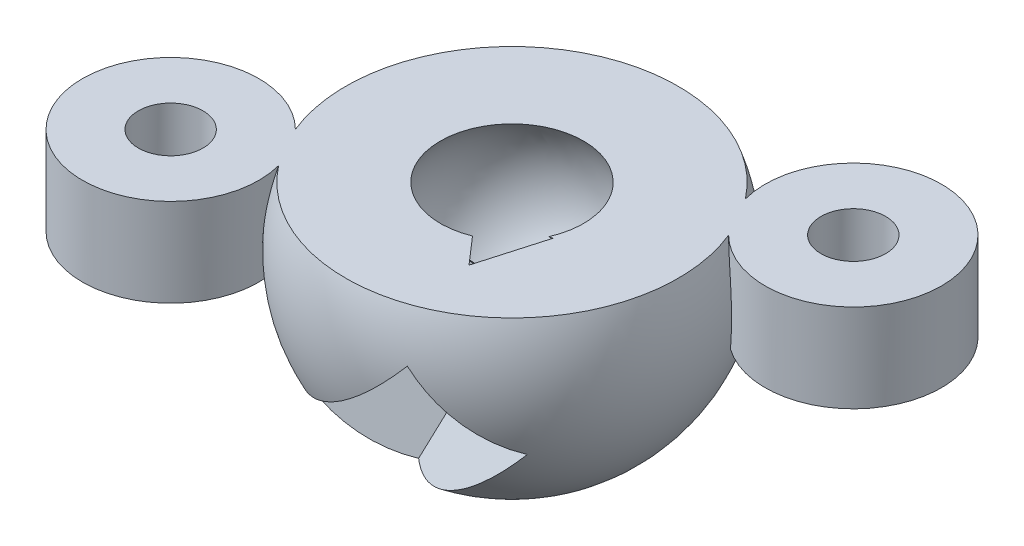
from build123d import *

# Parameters (mm, degrees)
RETAINER_FEATURE_3_PROFILE_R = 3
RETAINER_FEATURE_3_DEPTH     = 3
RETAINER_FEATURE_4_PROFILE_R = 3
RETAINER_FEATURE_4_DEPTH     = 3
RETAINER_FEATURE_6_PROFILE_R = 1.1
RETAINER_FEATURE_6_DEPTH     = 4.25
RETAINER_FEATURE_7_PROFILE_R = 2.1
RETAINER_FEATURE_7_DEPTH     = 1.45
RETAINER_FEATURE_8_PROFILE_R = 1.1
RETAINER_FEATURE_8_DEPTH     = 4.25
RETAINER_FEATURE_9_PROFILE_R = 2.1
RETAINER_FEATURE_9_DEPTH     = 1.45
RETAINER_FEATURE_12_DEPTH    = 10


with BuildPart() as part:
    # Retainer Dome Section Sketch → Retainer Dome (revolve)
    with BuildSketch(Plane(origin=(-42.218738434, 0, 24.375), x_dir=(-0.5000000000000002, 0, -0.8660254037844386), z_dir=(0.8660254037844386, 0, -0.5000000000000002)), mode=Mode.PRIVATE) as retainer_dome_sk:
        with BuildLine():
            Line((63.802679872, -71), (58.145825623, -71))
            Line((58.145825623, -71), (58.145825623, -79))
            ThreePointArc((58.145825623, -79), (63.044805109, -76.464101615), (63.802679872, -71))
        make_face()
    revolve(retainer_dome_sk.sketch.rotate(Axis((-71.291651246, -83, -25.980762114), (0, 1, 0)), 180), axis=Axis((-71.291651246, -83, -25.980762114), (0, 1, 0)))

    # Retainer Feature 3 profile → Retainer Feature 3 (add)
    with BuildSketch(Plane(origin=(0, -71, 0), x_dir=(-1, 0, 0), z_dir=(0, -1, 0))):
        with Locations((78.652867178, 21.730762114)):
            Circle(RETAINER_FEATURE_3_PROFILE_R)
    extrude(amount=RETAINER_FEATURE_3_DEPTH)

    # Retainer Feature 4 profile → Retainer Feature 4 (add)
    with BuildSketch(Plane(origin=(0, -71, 0), x_dir=(-1, 0, 0), z_dir=(0, -1, 0))):
        with Locations((63.930435314, 30.230762114)):
            Circle(RETAINER_FEATURE_4_PROFILE_R)
    extrude(amount=RETAINER_FEATURE_4_DEPTH)

    # Spherical Seat Sketch → Spherical Seat (revolve, cut)
    with BuildSketch(Plane(origin=(0, -73, 0), x_dir=(-1, 0, 0), z_dir=(0, -1, 0))):
        with BuildLine():
            Line((68.563671224, 27.555762114), (74.019631268, 24.405762114))
            ThreePointArc((74.019631268, 24.405762114), (72.866651246, 28.708742135), (68.563671224, 27.555762114))
        make_face()
    revolve(axis=Axis((-79.951905284, -73, -20.980762114), (0.8660254037844387, 0, -0.49999999999999994)), mode=Mode.SUBTRACT)

    # Retainer Feature 6 profile → Retainer Feature 6 (cut)
    with BuildSketch(Plane(origin=(0, -70, 0), x_dir=(-1, 0, 0), z_dir=(0, -1, 0))):
        with Locations(Location((78.652867178, 21.730762114, 0), (0, 0, 270))):
            Circle(RETAINER_FEATURE_6_PROFILE_R)
    extrude(amount=RETAINER_FEATURE_6_DEPTH, mode=Mode.SUBTRACT)

    # Retainer Feature 7 profile → Retainer Feature 7 (cut)
    with BuildSketch(Plane(origin=(0, -72.8, 0), x_dir=(-1, 0, 0), z_dir=(0, -1, 0))):
        with Locations(Location((78.652867178, 21.730762114, 0), (0, 0, 90))):
            Circle(RETAINER_FEATURE_7_PROFILE_R)
    extrude(amount=RETAINER_FEATURE_7_DEPTH, mode=Mode.SUBTRACT)

    # Retainer Feature 8 profile → Retainer Feature 8 (cut)
    with BuildSketch(Plane(origin=(0, -70, 0), x_dir=(-1, 0, 0), z_dir=(0, -1, 0))):
        with Locations(Location((63.930435314, 30.230762114, 0), (0, 0, 270))):
            Circle(RETAINER_FEATURE_8_PROFILE_R)
    extrude(amount=RETAINER_FEATURE_8_DEPTH, mode=Mode.SUBTRACT)

    # Retainer Feature 9 profile → Retainer Feature 9 (cut)
    with BuildSketch(Plane(origin=(0, -72.8, 0), x_dir=(-1, 0, 0), z_dir=(0, -1, 0))):
        with Locations(Location((63.930435314, 30.230762114, 0), (0, 0, 90))):
            Circle(RETAINER_FEATURE_9_PROFILE_R)
    extrude(amount=RETAINER_FEATURE_9_DEPTH, mode=Mode.SUBTRACT)

    # Middle Right Fixed Compression Ball Reta → Retainer Feature 12 (cut)
    with BuildSketch(Plane(origin=(1.086994367, -4.928521801, 7.638884182), x_dir=(0.9929271814083492, 0.06436591369238973, -0.09976292685669827), z_dir=(0.11872494439026321, -0.5383086561091618, 0.8343429620590547))):
        Polygon((-71.383097319, -72.025221064), (-76.603554069, -75.727494869), (-74.405328998, -78.827141064), (-69.184872248, -75.12486726), align=None)
    extrude(amount=RETAINER_FEATURE_12_DEPTH, mode=Mode.SUBTRACT)


solid = part.part
